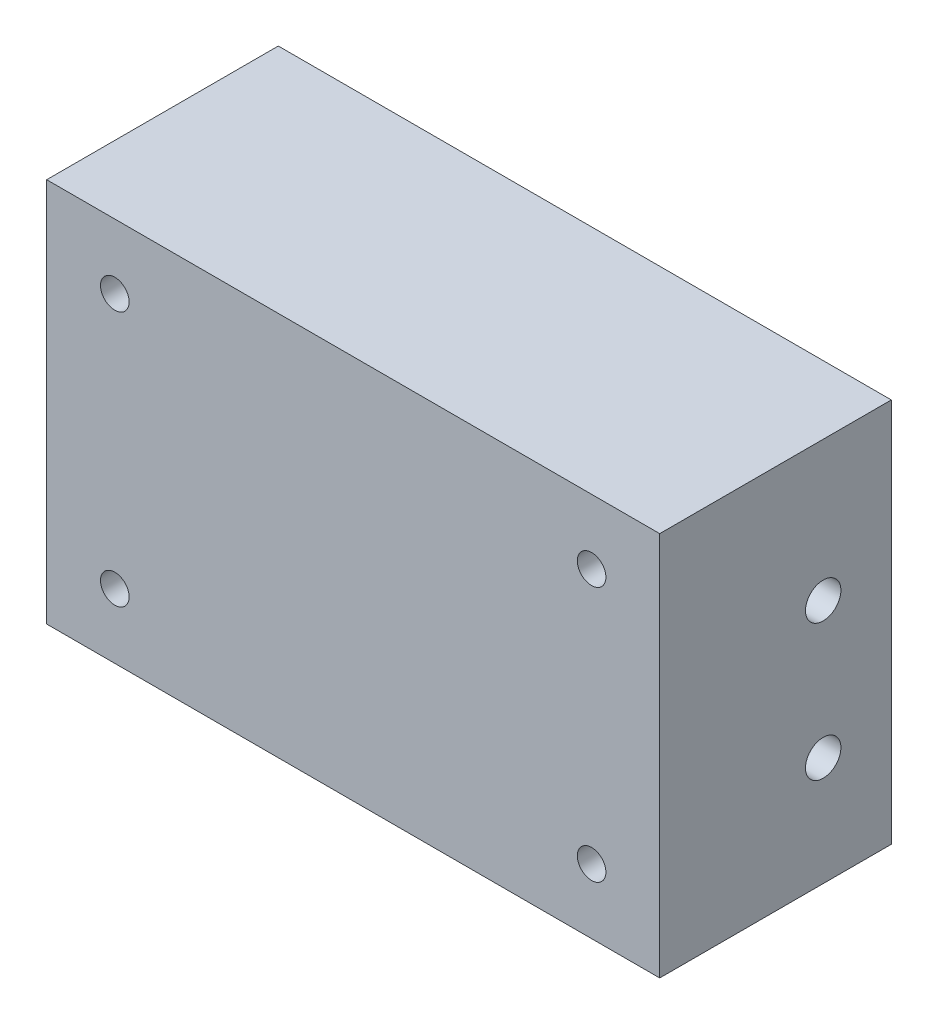
from build123d import *

# Parameters (mm, degrees)
SKETCH1_W           = 5.08
SKETCH1_H           = 61.595
SKETCH1_W_2         = 104.14
SKETCH1_R           = 2.667
BOSS_EXTRUDE1_DEPTH = 5.08
SKETCH1_3_W         = 5.08
SKETCH1_3_H         = 61.595
BOSS_EXTRUDE2_DEPTH = 38.1
SKETCH2_R           = 3.302
CUT_EXTRUDE1_DEPTH  = 125.356688627
SKETCH3_W           = 114.3
SKETCH3_H           = 43.18
BOSS_EXTRUDE3_DEPTH = 5.08
BOSS_EXTRUDE4_START = -61.595
SKETCH3_3_W         = 114.3
SKETCH3_3_H         = 43.18
BOSS_EXTRUDE4_DEPTH = 5.08


with BuildPart() as part:
    # Sketch1 → Boss-Extrude1 (new body)
    # profile 1 of 3: a face of its own
    with BuildSketch(Plane.XY):
        with Locations((-54.61, 0)):
            Rectangle(SKETCH1_W, SKETCH1_H)
    # profile 2 of 3: a face of its own
    with BuildSketch(Plane.XY):
        Rectangle(SKETCH1_W_2, SKETCH1_H)
        with Locations((-44.45, -23.8125)):
            Circle(SKETCH1_R, mode=Mode.SUBTRACT)
        with Locations((44.45, -23.8125)):
            Circle(SKETCH1_R, mode=Mode.SUBTRACT)
        with Locations((-44.45, 23.8125)):
            Circle(SKETCH1_R, mode=Mode.SUBTRACT)
        with Locations((44.45, 23.8125)):
            Circle(SKETCH1_R, mode=Mode.SUBTRACT)
    # profile 3 of 3: a face of its own
    with BuildSketch(Plane.XY):
        with Locations((54.61, 0)):
            Rectangle(SKETCH1_W, SKETCH1_H)
    extrude(amount=BOSS_EXTRUDE1_DEPTH)

    # Sketch1<3> → Boss-Extrude2 (add)
    with BuildSketch(Plane.XY):
        with Locations((-54.61, 0)):
            Rectangle(SKETCH1_3_W, SKETCH1_3_H)
        with Locations((54.61, 0)):
            Rectangle(SKETCH1_3_W, SKETCH1_3_H)
    extrude(amount=-BOSS_EXTRUDE2_DEPTH)

    # Sketch2 → Cut-Extrude1 (cut, through all)
    with BuildSketch(Plane(origin=(57.15, 0, 0), x_dir=(0, 0, -1), z_dir=(1, 0, 0))):
        with Locations((25.4, -15.5575)):
            Circle(SKETCH2_R)
        with Locations((25.4, 9.8425)):
            Circle(SKETCH2_R)
    extrude(amount=-CUT_EXTRUDE1_DEPTH, mode=Mode.SUBTRACT)

    # Sketch3 → Boss-Extrude3 (add)
    with BuildSketch(Plane(origin=(0, 30.7975, 0), x_dir=(1, 0, 0), z_dir=(0, 1, 0))):
        with Locations((0, 16.51)):
            Rectangle(SKETCH3_W, SKETCH3_H)
    extrude(amount=BOSS_EXTRUDE3_DEPTH)

    # Sketch3<3> → Boss-Extrude4 (add)
    with BuildSketch(Plane(origin=(0, 30.7975, 0), x_dir=(1, 0, 0), z_dir=(0, 1, 0)).offset(BOSS_EXTRUDE4_START)):
        with Locations((0, 16.51)):
            Rectangle(SKETCH3_3_W, SKETCH3_3_H)
    extrude(amount=-BOSS_EXTRUDE4_DEPTH)


solid = part.part
